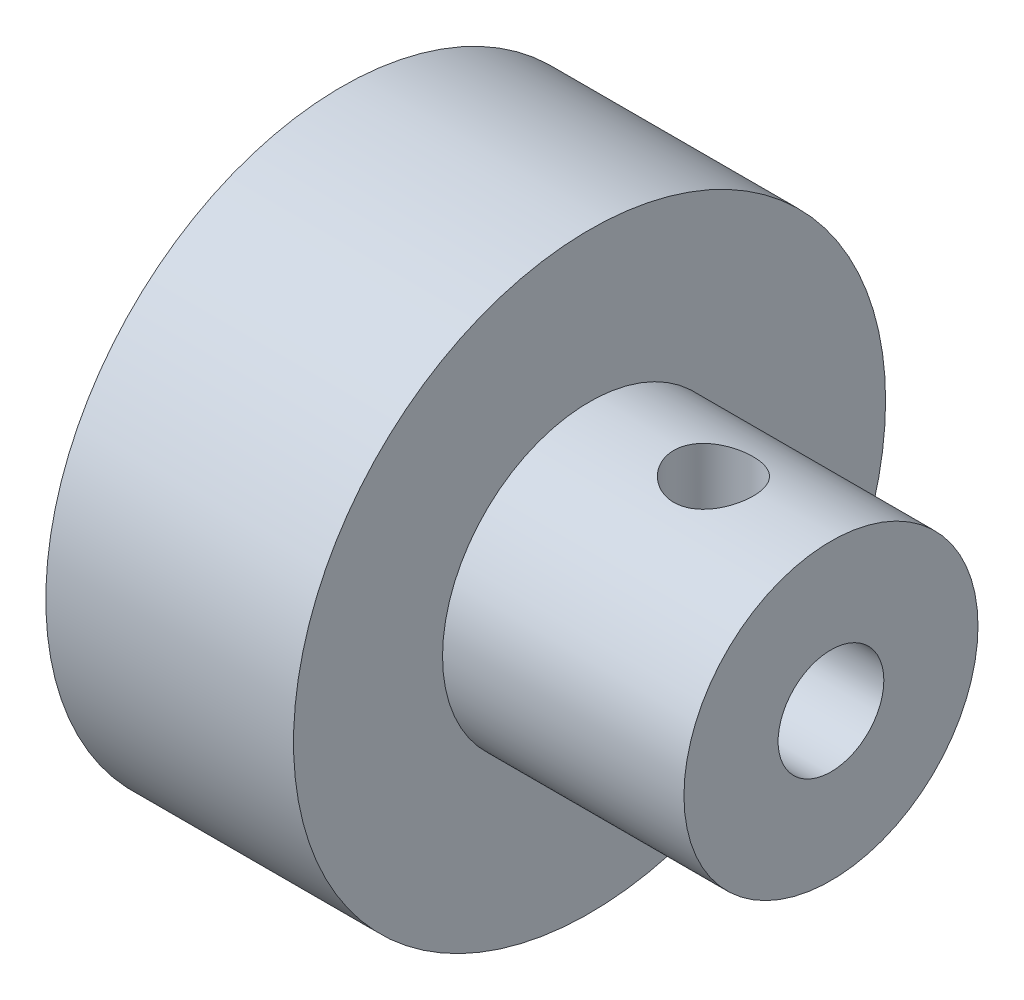
from build123d import *

# Parameters (mm, degrees)
CUT_EXTRUDE1_DEPTH      = 20.334926531
CUT_EXTRUDE1_DEPTH_BACK = 20.334926531
SKETCH2_R               = 1.190625


with BuildPart() as part:
    # Sketch1 → Revolve1 (revolve)
    with BuildSketch(Plane.XY):
        Polygon((0, 1.5875), (0, 4.415252691), (-7.250077802, 4.415252691), (-7.250077802, 8.89), (-14.689288069, 8.89), (-14.689288069, 1.5875), align=None)
    revolve(axis=Axis((0, 0, 0), (-1, 0, 0)))

    # Sketch2 → Cut-Extrude1 (cut, two sides: drawn at the far end of the back side and taken through both)
    with BuildSketch(Plane(origin=(0, 0, 0), x_dir=(1, 0, 0), z_dir=(0, 1, 0)).offset(-CUT_EXTRUDE1_DEPTH_BACK)):
        with Locations((-3.529556327, 0)):
            Circle(SKETCH2_R)
    extrude(amount=CUT_EXTRUDE1_DEPTH + CUT_EXTRUDE1_DEPTH_BACK, mode=Mode.SUBTRACT)


solid = part.part
